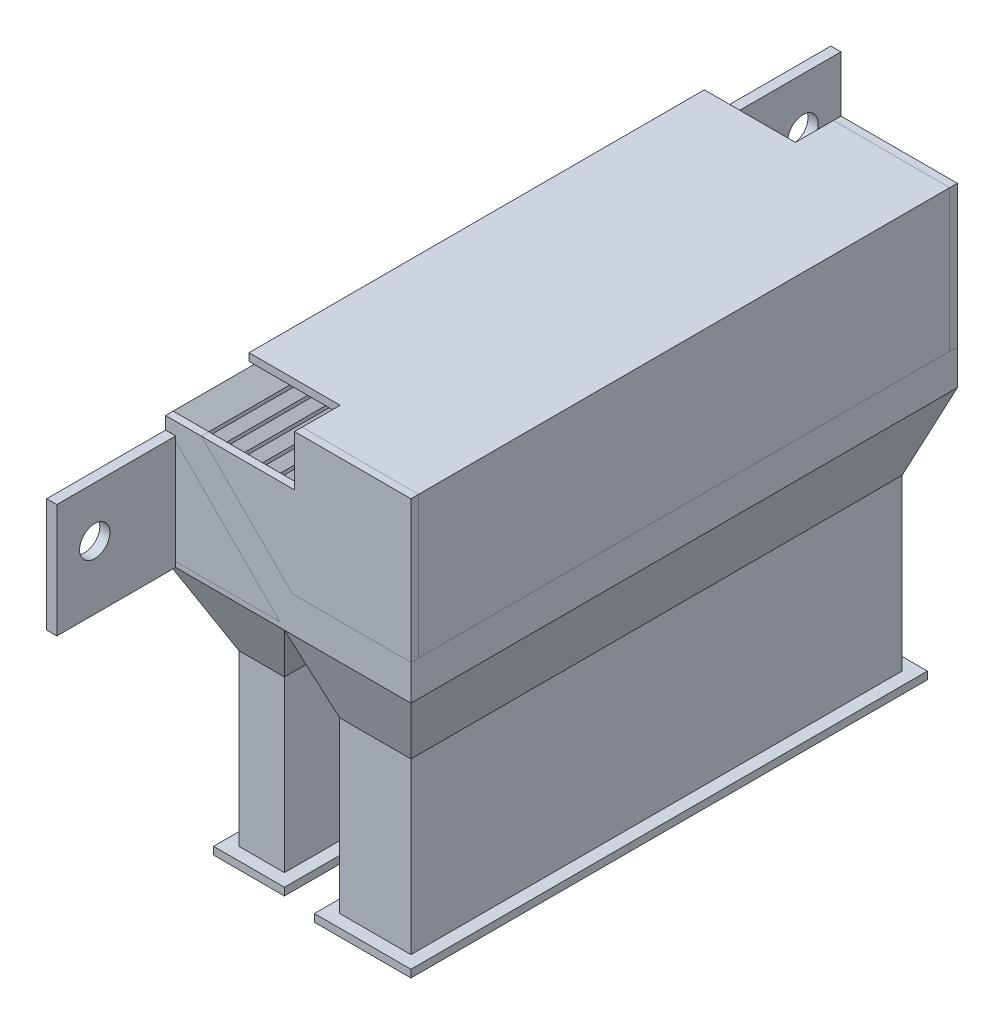
from build123d import *

# Parameters (mm, degrees)
EXTRUDE_1_DEPTH      = 216
SHELL_1_T            = -2
SKETCH_2_W           = 310
SKETCH_2_H           = 45
EXTRUDE_3_DEPTH      = 4
SKETCH_4_W           = 3
SKETCH_4_H           = 70.710678118
EXTRUDE_4_DEPTH      = 10
SKETCH_6_W           = 210
SKETCH_6_H           = 1
CUT_EXTRUDE_5_DEPTH  = 3
SKETCH_7_W           = 40
SKETCH_7_H           = 210
CUT_EXTRUDE_8_DEPTH  = 3
SKETCH_8_W           = 46
SKETCH_8_H           = 216
EXTRUDE_9_DEPTH      = 30
EXTRUDE_9_TAPER      = 25
SHELL_2_T            = -3
SKETCH_9_W           = 50
SKETCH_9_H           = 216
EXTRUDE_12_DEPTH     = 30
EXTRUDE_12_TAPER     = 20
SHELL_3_T            = -3
SKETCH_10_R          = 6
CUT_EXTRUDE_13_DEPTH = 30
EXTRUDE_15_DEPTH     = 14
SKETCH_12_W          = 25.097226058
SKETCH_12_H          = 7.718549469
CUT_EXTRUDE_16_DEPTH = 300
SKETCH_13_W          = 28.161785944
SKETCH_13_H          = 194.161785944
SKETCH_13_W_2        = 22.161785944
SKETCH_13_H_2        = 188.161785944
EXTRUDE_17_DEPTH     = 70
SKETCH_14_W          = 18.02154051
SKETCH_14_H          = 188.02154051
SKETCH_14_W_2        = 12.02154051
SKETCH_14_H_2        = 182.02154051
EXTRUDE_18_DEPTH     = 70
EXTRUDE_19_DEPTH     = 3
EXTRUDE_19_2_DEPTH   = 3
EXTRUDE_20_DEPTH     = 210
CUT_EXTRUDE_1_DEPTH  = 20
SKETCH_18_W          = 28.02154051
SKETCH_18_H          = 198.02154051
SKETCH_18_W_2        = 18.02154051
SKETCH_18_H_2        = 188.02154051
SKETCH_18_W_3        = 38.161785944
SKETCH_18_H_3        = 204.161785944
SKETCH_18_W_4        = 28.161785944
SKETCH_18_H_4        = 194.161785944
EXTRUDE_21_DEPTH     = 3


with BuildPart() as part:
    # 草图1 → 拉伸1 (new body)
    with BuildSketch(Plane.XY):
        Polygon((0, 0), (0, 50), (50, 0), align=None)
    extrude(amount=EXTRUDE_1_DEPTH)

    # 抽壳1
    shell_1_openings = [part.faces().sort_by_distance(p)[0] for p in [
        (16.666666667, 16.666666667, 216),
        (16.666666667, 16.666666667, 0),
    ]]
    offset(amount=SHELL_1_T, openings=shell_1_openings, kind=Kind.INTERSECTION)

    # 草图2 → 拉伸3 (add)
    with BuildSketch(Plane(origin=(0, 0, 0), x_dir=(0, 0, -1), z_dir=(1, 0, 0))):
        with Locations((-108, 22.5)):
            Rectangle(SKETCH_2_W, SKETCH_2_H)
    extrude(amount=EXTRUDE_3_DEPTH)

    # 草图4 → 拉伸4 (add)
    with BuildSketch(Plane(origin=(25, 25, 0), x_dir=(0, 0, -1), z_dir=(0.7071067811865477, 0.7071067811865475, 0))):
        with Locations((-214.5, 0)):
            Rectangle(SKETCH_4_W, SKETCH_4_H)
        with Locations((-1.5, 0)):
            Rectangle(SKETCH_4_W, SKETCH_4_H)
    extrude(amount=EXTRUDE_4_DEPTH)

    # 草图6 → 拉伸5 (cut)
    with BuildSketch(Plane(origin=(25, 25, 0), x_dir=(0, 0, -1), z_dir=(0.7071067811865477, 0.7071067811865475, 0))):
        with Locations((-108, 24.855339059)):
            Rectangle(SKETCH_6_W, SKETCH_6_H)
        with Locations((-108, 19.855339059)):
            Rectangle(SKETCH_6_W, SKETCH_6_H)
        with Locations((-108, 14.855339059)):
            Rectangle(SKETCH_6_W, SKETCH_6_H)
        with Locations((-108, 9.855339059)):
            Rectangle(SKETCH_6_W, SKETCH_6_H)
        with Locations((-108, 4.855339059)):
            Rectangle(SKETCH_6_W, SKETCH_6_H)
        with Locations((-108, -0.144660941)):
            Rectangle(SKETCH_6_W, SKETCH_6_H)
        with Locations((-108, -5.144660941)):
            Rectangle(SKETCH_6_W, SKETCH_6_H)
        with Locations((-108, -10.144660941)):
            Rectangle(SKETCH_6_W, SKETCH_6_H)
        with Locations((-108, -15.144660941)):
            Rectangle(SKETCH_6_W, SKETCH_6_H)
        with Locations((-108, -20.144660941)):
            Rectangle(SKETCH_6_W, SKETCH_6_H)
        with Locations((-108, -25.144660941)):
            Rectangle(SKETCH_6_W, SKETCH_6_H)
        with Locations((-108, -30.144660941)):
            Rectangle(SKETCH_6_W, SKETCH_6_H)
    extrude(amount=-CUT_EXTRUDE_5_DEPTH, mode=Mode.SUBTRACT)

    # 草图7 → 拉伸8 (cut)
    with BuildSketch(Plane.XZ):
        with Locations((24, 108)):
            Rectangle(SKETCH_7_W, SKETCH_7_H)
    extrude(amount=-CUT_EXTRUDE_8_DEPTH, mode=Mode.SUBTRACT)

    # 草图10 → 拉伸13 (cut)
    with BuildSketch(Plane(origin=(4, 0, 0), x_dir=(0, 0, -1), z_dir=(1, 0, 0))):
        with Locations((-248, 25)):
            Circle(SKETCH_10_R)
        with Locations((32, 25)):
            Circle(SKETCH_10_R)
    extrude(amount=-CUT_EXTRUDE_13_DEPTH, mode=Mode.SUBTRACT)



with BuildPart() as body_2:
    # 草图8 → 拉伸9 (new body)
    with BuildSketch(Plane.XZ):
        with Locations((24, 108)):
            Rectangle(SKETCH_8_W, SKETCH_8_H)
    extrude(amount=EXTRUDE_9_DEPTH, taper=EXTRUDE_9_TAPER)

    # 抽壳2
    shell_2_openings = [body_2.faces().sort_by_distance(p)[0] for p in [
        (24, -30, 108),
        (24, 0, 108),
    ]]
    offset(amount=SHELL_2_T, openings=shell_2_openings, kind=Kind.INTERSECTION)


with BuildPart() as body_3:
    # 草图9 → 拉伸12 (new body)
    with BuildSketch(Plane.XZ):
        with Locations((72, 108)):
            Rectangle(SKETCH_9_W, SKETCH_9_H)
    extrude(amount=EXTRUDE_12_DEPTH, taper=EXTRUDE_12_TAPER)

    # 抽壳3
    shell_3_openings = [body_3.faces().sort_by_distance(p)[0] for p in [
        (72, -30, 108),
        (72, 0, 108),
    ]]
    offset(amount=SHELL_3_T, openings=shell_3_openings, kind=Kind.INTERSECTION)


with BuildPart() as part_1:
    add(part.part)

    add(body_3.part)  # 拉伸15 merges body 3
    # 草图11 → 拉伸15 (add)
    with BuildSketch(Plane(origin=(0, 0, 0), x_dir=(1, 0, 0), z_dir=(0, 1, 0))):
        Polygon((94, -213), (50, -213), (50, -216), (97, -216), (97, 0), (50, 0), (50, -3), (94, -3), align=None)
    extrude(amount=EXTRUDE_15_DEPTH)

    # 草图12 → 拉伸16 (cut)
    with BuildSketch(Plane(origin=(0, 0, -47), x_dir=(-1, 0, 0), z_dir=(0, 0, -1))):
        with Locations((-12.548613029, 53.859274735)):
            Rectangle(SKETCH_12_W, SKETCH_12_H)
    extrude(amount=-CUT_EXTRUDE_16_DEPTH, mode=Mode.SUBTRACT)


with BuildPart() as body_3_2:
    # 草图13 → 拉伸17 (new body)
    with BuildSketch(Plane.XZ.offset(30)):
        with Locations((72, 108)):
            Rectangle(SKETCH_13_W, SKETCH_13_H)
        with Locations((72, 108)):
            Rectangle(SKETCH_13_W_2, SKETCH_13_H_2, mode=Mode.SUBTRACT)
    extrude(amount=EXTRUDE_17_DEPTH)



with BuildPart() as body_4:
    # 草图14 → 拉伸18 (new body)
    with BuildSketch(Plane.XZ.offset(30)):
        with Locations((24, 108)):
            Rectangle(SKETCH_14_W, SKETCH_14_H)
        with Locations((24, 108)):
            Rectangle(SKETCH_14_W_2, SKETCH_14_H_2, mode=Mode.SUBTRACT)
    extrude(amount=EXTRUDE_18_DEPTH)


with BuildPart() as body_5:
    # 草图15 → 拉伸19 (new body)
    with BuildSketch(Plane(origin=(0, 0, 0), x_dir=(-1, 0, 0), z_dir=(0, 0, -1))):
        Polygon((-14.142135624, 50), (0, 50), (0, 70), (-97, 70), (-97, 50), (-97, 14), (-50.142135624, 14), align=None)
    extrude(amount=-EXTRUDE_19_DEPTH)


with BuildPart() as body_6:
    # 草图15 → Extrude 19 2 (new body)
    with BuildSketch(Plane(origin=(0, 0, 0), x_dir=(-1, 0, 0), z_dir=(0, 0, -1))):
        Polygon((-4, 43.171572875), (-45.171572875, 2), (-4, 2), align=None)
    extrude(amount=-EXTRUDE_19_2_DEPTH)


with BuildPart() as body_7:
    # 镜向2: mirrored copy
    add(body_5.part.mirror(Plane.XY.offset(108)))


with BuildPart() as body_8:
    # Mirror 2 2: mirrored copy
    add(body_6.part.mirror(Plane.XY.offset(108)))


with BuildPart() as body_9:
    # 草图16 → 拉伸20 (new body)
    with BuildSketch(Plane.XY.offset(3)):
        Polygon((97, 14), (97, 70), (0, 70), (0, 67), (94, 67), (94, 14), align=None)
    extrude(amount=EXTRUDE_20_DEPTH)


with BuildPart() as cut_extrude_1_tool:
    # 草图17 → 切除-拉伸1 (new body)
    with BuildSketch(Plane(origin=(0, 70, 0), x_dir=(1, 0, 0), z_dir=(0, 1, 0))):
        Polygon((0, -216), (51, -216), (51, -198), (15, -198), (15, -18), (51, -18), (51, 0), (0, 0), align=None)
    extrude(amount=-CUT_EXTRUDE_1_DEPTH)


with BuildPart() as body_5_1:
    add(body_5.part)

    # 切除-拉伸1: cut by cut_extrude_1_tool
    add(cut_extrude_1_tool.part, mode=Mode.SUBTRACT)


with BuildPart() as body_7_1:
    add(body_7.part)

    # 切除-拉伸1: cut by cut_extrude_1_tool
    add(cut_extrude_1_tool.part, mode=Mode.SUBTRACT)


with BuildPart() as body_9_1:
    add(body_9.part)

    # 切除-拉伸1: cut by cut_extrude_1_tool
    add(cut_extrude_1_tool.part, mode=Mode.SUBTRACT)


with BuildPart() as body_3_2_1:
    add(body_3_2.part)

    add(body_4.part)  # 拉伸21 merges body 4
    # 草图18 → 拉伸21 (add)
    # profile 1 of 2: a face of its own
    with BuildSketch(Plane.XZ.offset(100)):
        with Locations((24, 108)):
            Rectangle(SKETCH_18_W, SKETCH_18_H)
        with Locations((24, 108)):
            Rectangle(SKETCH_18_W_2, SKETCH_18_H_2, mode=Mode.SUBTRACT)
    # profile 2 of 2: a face of its own
    with BuildSketch(Plane.XZ.offset(100)):
        with Locations((72, 108)):
            Rectangle(SKETCH_18_W_3, SKETCH_18_H_3)
        with Locations((72, 108)):
            Rectangle(SKETCH_18_W_4, SKETCH_18_H_4, mode=Mode.SUBTRACT)
    extrude(amount=-EXTRUDE_21_DEPTH)


solid = Compound([body_2.part, part_1.part, body_6.part, body_8.part, body_5_1.part, body_7_1.part, body_9_1.part, body_3_2_1.part])
